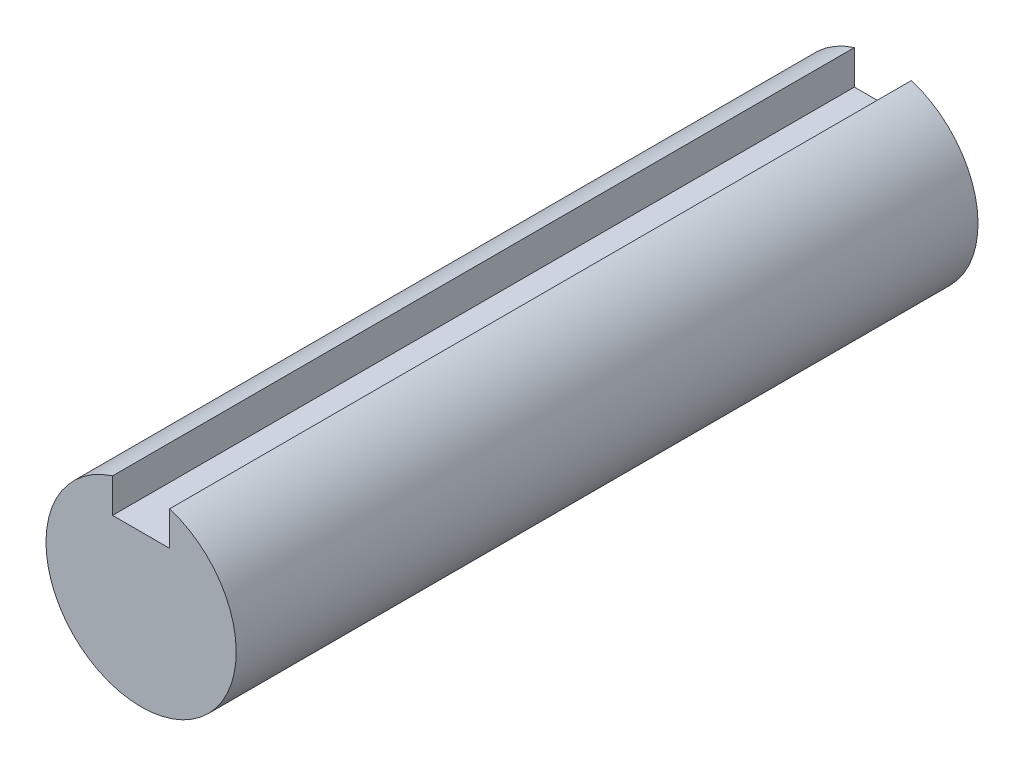
from build123d import *

# Parameters (mm, degrees)
ESTRUSIONE_ESTRUSIONE1_DEPTH = 39


with BuildPart() as part:
    # Schizzo1 → Estrusione-Estrusione1 (new body)
    with BuildSketch(Plane.XY):
        with BuildLine():
            Line((1.5, 2.969696007), (-1.5, 2.969696007))
            Line((-1.5, 2.969696007), (-1.5, 4.769696007))
            ThreePointArc((-1.5, 4.769696007), (-2.958039892, -4.031128874), (5, 0))
            ThreePointArc((5, 0), (4.031128874, 2.958039892), (1.5, 4.769696007))
            Line((1.5, 4.769696007), (1.5, 2.969696007))
        make_face()
    extrude(amount=ESTRUSIONE_ESTRUSIONE1_DEPTH)


solid = part.part
